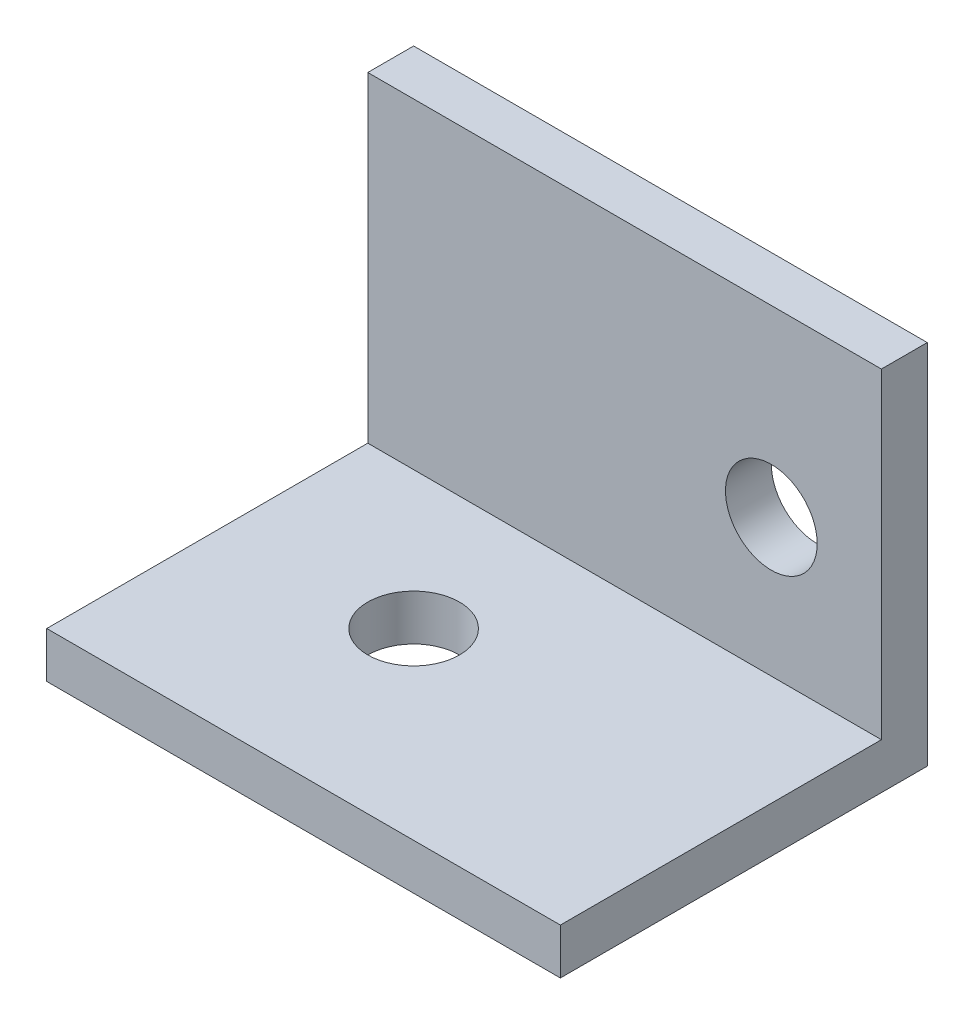
from build123d import *

# Parameters (mm, degrees)
SKETCH1_W           = 35.56
SKETCH1_H           = 25.4
BOSS_EXTRUDE1_DEPTH = 3.175
SKETCH2_W           = 35.56
SKETCH2_H           = 3.175
BOSS_EXTRUDE2_DEPTH = 22.225
SKETCH3_R           = 3.175
CUT_EXTRUDE1_DEPTH  = 3.175
SKETCH4_R           = 3.175
CUT_EXTRUDE2_DEPTH  = 3.175


with BuildPart() as part:
    # Sketch1 → Boss-Extrude1 (new body)
    with BuildSketch(Plane(origin=(0, 0, 0), x_dir=(1, 0, 0), z_dir=(0, 1, 0))):
        Rectangle(SKETCH1_W, SKETCH1_H)
    extrude(amount=BOSS_EXTRUDE1_DEPTH)

    # Sketch2 → Boss-Extrude2 (add)
    with BuildSketch(Plane(origin=(0, 3.175, 0), x_dir=(1, 0, 0), z_dir=(0, 1, 0))):
        with Locations((0, 11.1125)):
            Rectangle(SKETCH2_W, SKETCH2_H)
    extrude(amount=BOSS_EXTRUDE2_DEPTH)

    # Sketch3 → Cut-Extrude1 (cut)
    with BuildSketch(Plane(origin=(0, 3.175, 0), x_dir=(1, 0, 0), z_dir=(0, 1, 0))):
        with Locations(Location((-5.08, 0, 0), (0, 0, 270))):
            Circle(SKETCH3_R)
    extrude(amount=-CUT_EXTRUDE1_DEPTH, mode=Mode.SUBTRACT)

    # Sketch4 → Cut-Extrude2 (cut)
    with BuildSketch(Plane.XY.offset(-9.525)):
        with Locations((10.16, 12.7)):
            Circle(SKETCH4_R)
    extrude(amount=-CUT_EXTRUDE2_DEPTH, mode=Mode.SUBTRACT)


solid = part.part
